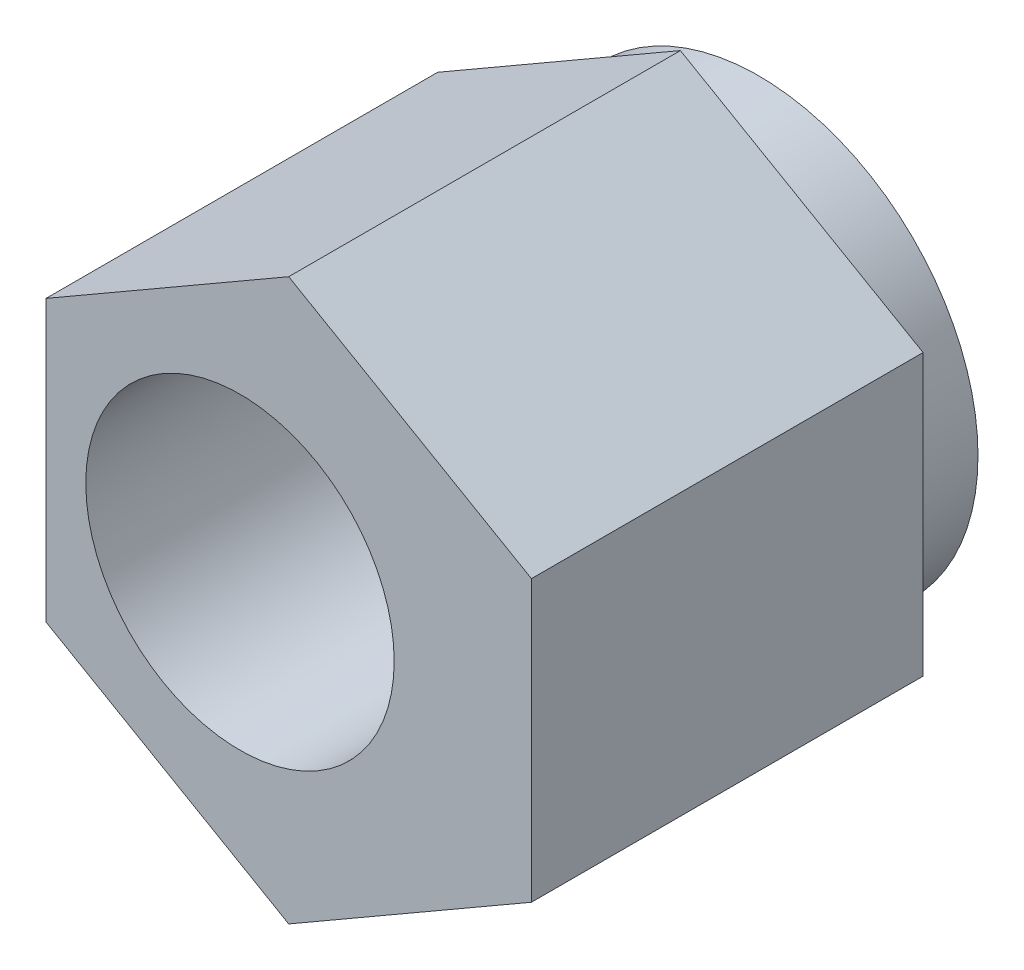
from build123d import *

# Parameters (mm, degrees)
SKETCH1_R           = 2.5
BOSS_EXTRUDE3_DEPTH = 6.35
BOSS_EXTRUDE4_START = -1.27
SKETCH1_5_R         = 3.555
SKETCH1_5_R_2       = 2.5
BOSS_EXTRUDE4_DEPTH = 1.27


with BuildPart() as part:
    # Sketch1 → Boss-Extrude3 (new body)
    with BuildSketch(Plane.XY):
        Polygon((4.725, 2.271873309), (0.79, 4.543746619), (-3.145, 2.271873309), (-3.145, -2.271873309), (0.79, -4.543746619), (4.725, -2.271873309), align=None)
        Circle(SKETCH1_R, mode=Mode.SUBTRACT)
    extrude(amount=BOSS_EXTRUDE3_DEPTH)

    # Sketch1<5> → Boss-Extrude4 (add)
    with BuildSketch(Plane.XY.offset(BOSS_EXTRUDE4_START)):
        with Locations((0.79, 0)):
            Circle(SKETCH1_5_R)
        Circle(SKETCH1_5_R_2, mode=Mode.SUBTRACT)
    extrude(amount=BOSS_EXTRUDE4_DEPTH)


solid = part.part
